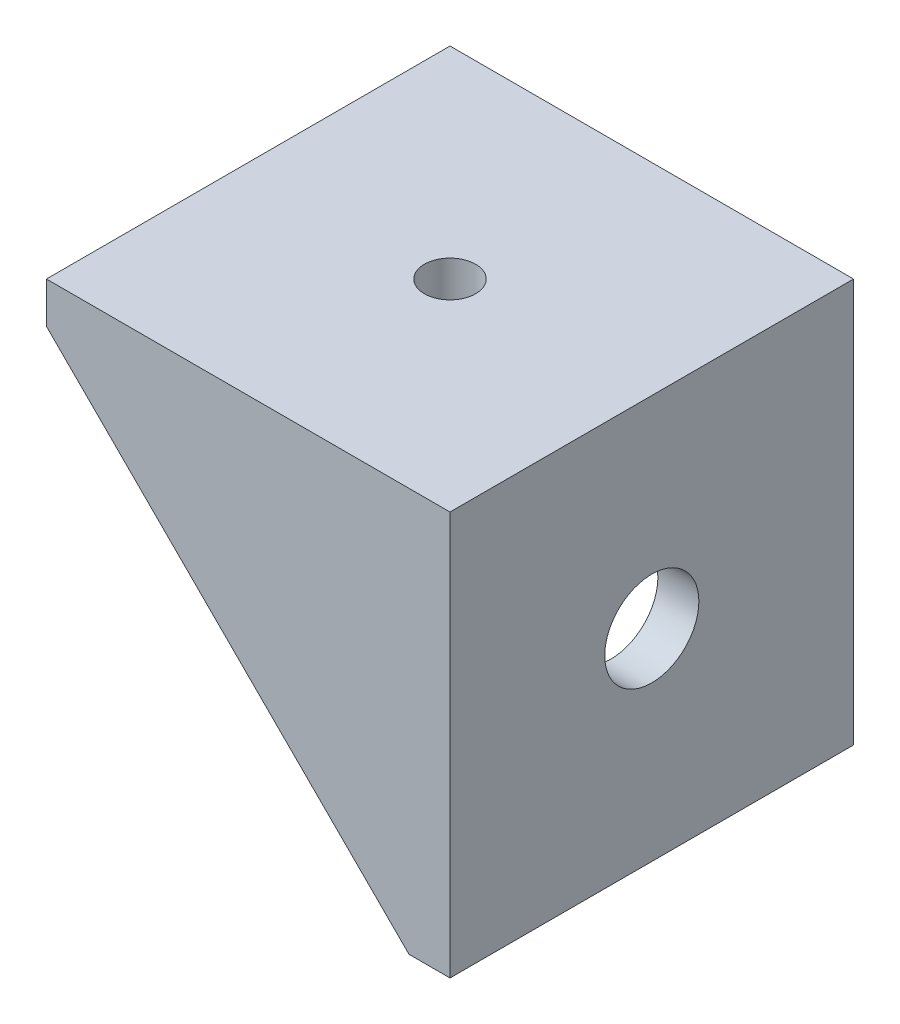
from build123d import *

# Parameters (mm, degrees)
BOSS_EXTRUDE1_DEPTH = 15
BOSS_EXTRUDE2_START = 15
BOSS_EXTRUDE2_DEPTH = 3.048
BOSS_EXTRUDE3_START = -15
BOSS_EXTRUDE3_DEPTH = 3.048
SKETCH2_R           = 1.905
CUT_EXTRUDE1_DEPTH  = 46
SKETCH3_R           = 3.5
CUT_EXTRUDE2_DEPTH  = 46


with BuildPart() as part:
    # Sketch1 → Boss-Extrude1 (new, symmetric)
    with BuildSketch(Plane.XY):
        Polygon((-3.048, -30), (0, -30), (0, 0), (-30, 0), (-30, -3.048), (-3.048, -3.048), align=None)
    extrude(amount=BOSS_EXTRUDE1_DEPTH, both=True)

    # Sketch1<3> → Boss-Extrude2 (add)
    with BuildSketch(Plane.XY.offset(BOSS_EXTRUDE2_START)):
        Polygon((-3.048, -30), (-30, -3.048), (-3.048, -3.048), align=None)
    extrude(amount=-BOSS_EXTRUDE2_DEPTH)

    # Sketch1<4> → Boss-Extrude3 (add)
    with BuildSketch(Plane.XY.offset(BOSS_EXTRUDE3_START)):
        Polygon((-3.048, -30), (-30, -3.048), (-3.048, -3.048), align=None)
    extrude(amount=BOSS_EXTRUDE3_DEPTH)

    # Sketch2 → Cut-Extrude1 (cut, through all)
    with BuildSketch(Plane(origin=(0, 0, 0), x_dir=(1, 0, 0), z_dir=(0, 1, 0))):
        with Locations(Location((-15, 0, 0), (0, 0, 270))):
            Circle(SKETCH2_R)
    extrude(amount=-CUT_EXTRUDE1_DEPTH, mode=Mode.SUBTRACT)

    # Sketch3 → Cut-Extrude2 (cut, through all)
    with BuildSketch(Plane(origin=(0, 0, 0), x_dir=(0, 0, -1), z_dir=(1, 0, 0))):
        with Locations((0, -15)):
            Circle(SKETCH3_R)
    extrude(amount=-CUT_EXTRUDE2_DEPTH, mode=Mode.SUBTRACT)


solid = part.part
